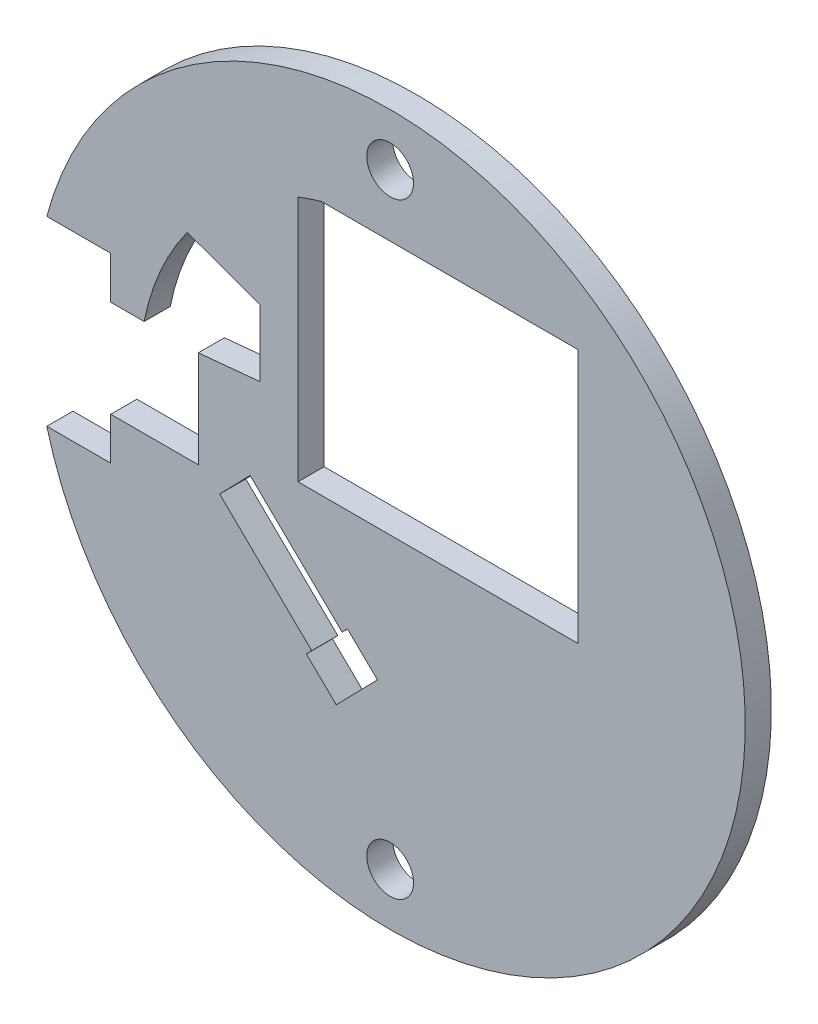
from build123d import *

# Parameters (mm, degrees)
SKETCH1_R           = 1.4224
BOSS_EXTRUDE2_DEPTH = 1.5875


with BuildPart() as part:
    # Sketch1 → Boss-Extrude2 (new body)
    with BuildSketch(Plane.XY):
        with BuildLine():
            Line((-7.9248, 3.302), (-11.65986156, 2.948480848))
            Line((-11.65986156, 2.948480848), (-11.65986156, -2.948480848))
            Line((-11.65986156, -2.948480848), (-16.984058744, -2.948480848))
            Line((-16.984058744, -2.948480848), (-16.984058744, -5.5245))
            Line((-16.984058744, -5.5245), (-20.871224203, -5.5245))
            ThreePointArc((-20.871224203, -5.5245), (21.59, 0), (-20.871224203, 5.5245))
            Line((-20.871224203, 5.5245), (-16.984058744, 5.5245))
            Line((-16.984058744, 5.5245), (-16.984058744, 2.948480848))
            Line((-16.984058744, 2.948480848), (-14.952058744, 2.948480848))
            ThreePointArc((-14.952058744, 2.948480848), (-13.968818521, 6.093415226), (-12.332576282, 8.9535))
            Line((-12.332576282, 8.9535), (-7.9248, 7.366))
            Line((-7.9248, 7.366), (-7.9248, 3.302))
        make_face()
        with BuildLine():
            Line((-5.6007, -0.8128), (-5.6007, 14.173558463))
            ThreePointArc((-5.6007, 14.173558463), (-4.895856129, 14.43219293), (-4.179129857, 14.6558))
            Line((-4.179129857, 14.6558), (4.179129857, 14.6558))
            Line((4.179129857, 14.6558), (11.43, 14.6558))
            Line((11.43, 14.6558), (11.43, -0.8128))
            Line((11.43, -0.8128), (-5.6007, -0.8128))
        make_face(mode=Mode.SUBTRACT)
        Polygon((-2.594132624, -7.054138602), (-0.7747, -8.8265), (-3.273729572, -11.3919), (-5.093162196, -9.619538602), (-4.769706241, -9.287492148), (-10.36446156, -3.837480848), (-8.512343898, -1.936173756), (-2.917588579, -7.386185056), align=None, mode=Mode.SUBTRACT)
        with Locations((0, -18.415)):
            Circle(SKETCH1_R, mode=Mode.SUBTRACT)
        with Locations((0, 18.415)):
            Circle(SKETCH1_R, mode=Mode.SUBTRACT)
    extrude(amount=BOSS_EXTRUDE2_DEPTH)


solid = part.part
